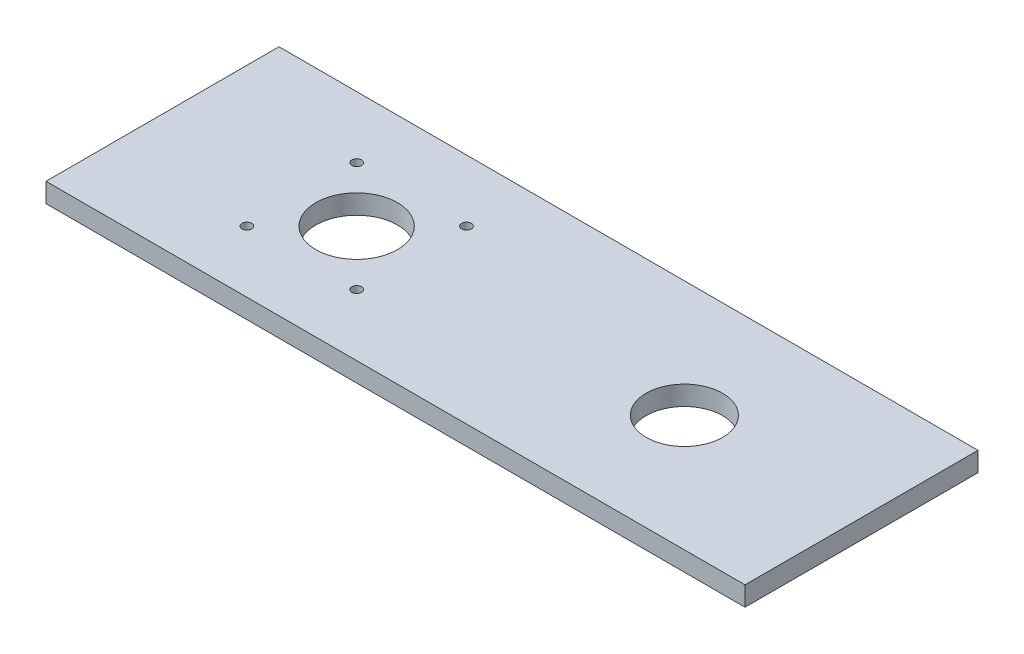
from build123d import *

# Parameters (mm, degrees)
SKETCH1_W             = 180
SKETCH1_H             = 60
SKETCH1_R             = 10.5
SKETCH1_R_2           = 9.848320848
BOSS_EXTRUDE1_DEPTH   = 5
M3X0_5_TAPPED_HOLE1_D = 2.5


with BuildPart() as part:
    # Sketch1 → Boss-Extrude1 (new body)
    with BuildSketch(Plane(origin=(0, 0, 0), x_dir=(1, 0, 0), z_dir=(0, 1, 0))):
        with Locations((40, 0)):
            Rectangle(SKETCH1_W, SKETCH1_H)
        with Locations(Location((0, 0, 0), (0, 0, 270))):
            Circle(SKETCH1_R, mode=Mode.SUBTRACT)
        with Locations(Location((84.38561279, 0, 0), (0, 0, 270))):
            Circle(SKETCH1_R_2, mode=Mode.SUBTRACT)
    extrude(amount=BOSS_EXTRUDE1_DEPTH)

    # M3x0.5 Tapped Hole1 (through all)
    with Locations(Plane(origin=(0, 5, 0), x_dir=(1, 0, 0), z_dir=(0, 1, 0))):
        with Locations((-14.142135624, 14.142135624), (14.142135624, 14.142135624), (14.142135624, -14.142135624), (-14.142135624, -14.142135624), (0, 0)):
            Hole(M3X0_5_TAPPED_HOLE1_D / 2)


solid = part.part
